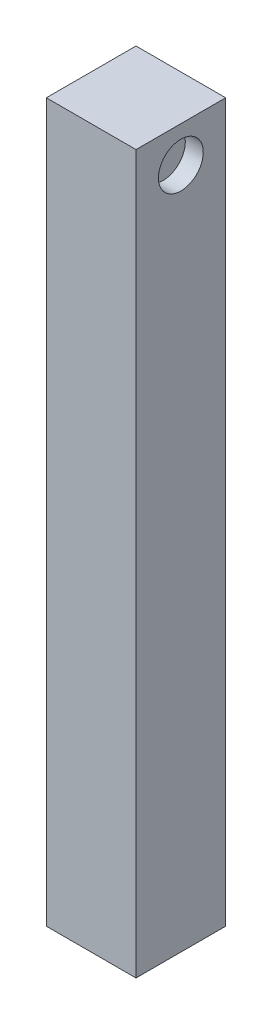
from build123d import *

# Parameters (mm, degrees)
SKETCH1_W           = 100
SKETCH1_H           = 800
BOSS_EXTRUDE1_DEPTH = 50
SKETCH2_R           = 25
CUT_EXTRUDE1_DEPTH  = 20


with BuildPart() as part:
    # Sketch1 → Boss-Extrude1 (new, symmetric)
    with BuildSketch(Plane(origin=(0, 0, 0), x_dir=(0, 0, -1), z_dir=(1, 0, 0))):
        Rectangle(SKETCH1_W, SKETCH1_H)
    extrude(amount=BOSS_EXTRUDE1_DEPTH, both=True)

    # Sketch2 → Cut-Extrude1 (cut)
    with BuildSketch(Plane(origin=(50, 0, 0), x_dir=(0, 0, -1), z_dir=(1, 0, 0))):
        with Locations((0, 360)):
            Circle(SKETCH2_R)
    extrude(amount=-CUT_EXTRUDE1_DEPTH, mode=Mode.SUBTRACT)


solid = part.part
